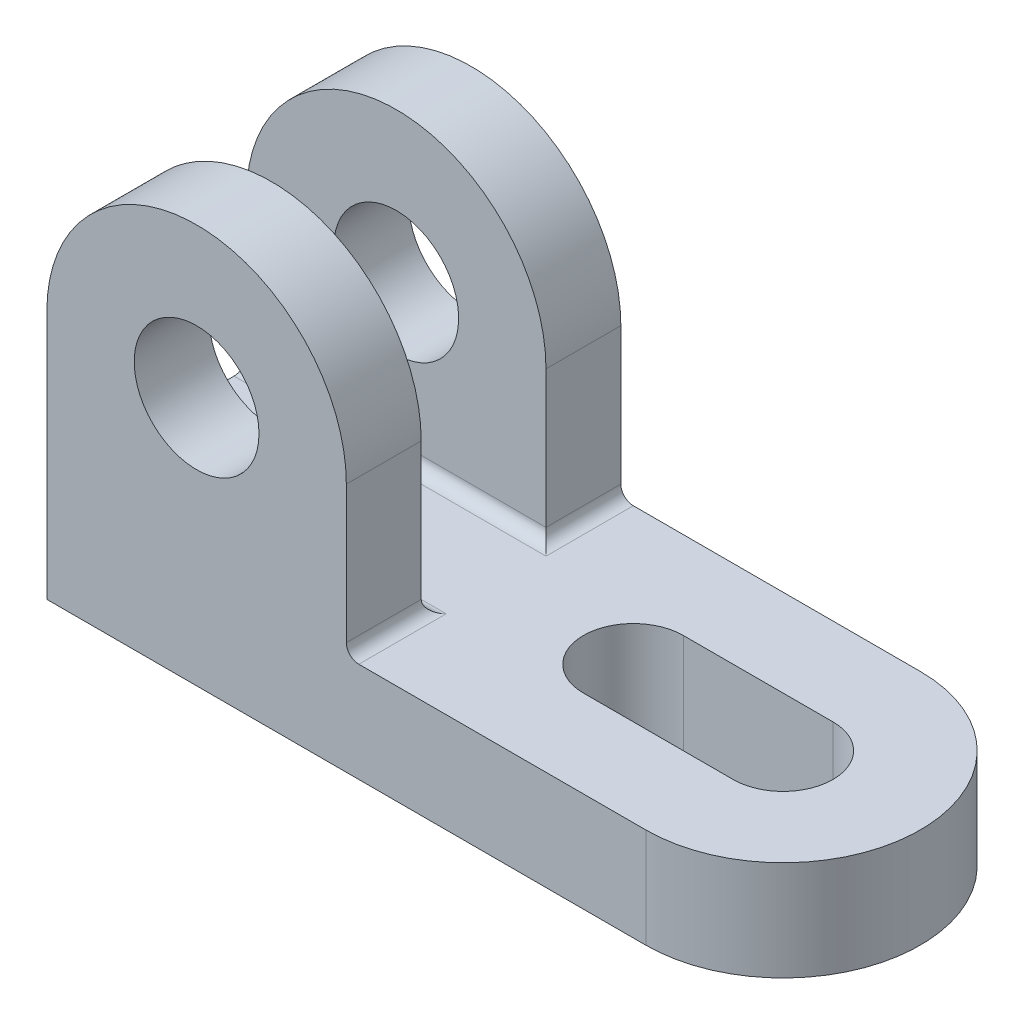
from build123d import *

# Parameters (mm, degrees)
SKETCH1_R           = 22
BOSS_EXTRUDE3_DEPTH = 16
CUT_EXTRUDE1_DEPTH  = 127.94880858
SKETCH3_R           = 24
SKETCH3_W           = 48
SKETCH3_H           = 24
BOSS_EXTRUDE5_DEPTH = 12
SKETCH6_R           = 10
CUT_EXTRUDE3_DEPTH  = 142.265707091
FILLET3_R           = 2


with BuildPart() as part:
    # Sketch1 → Boss-Extrude3 (new body)
    with BuildSketch(Plane(origin=(0, 0, 0), x_dir=(1, 0, 0), z_dir=(0, 1, 0))):
        with BuildLine():
            Line((0, 44), (0, 0))
            Line((0, 0), (96, 0))
            ThreePointArc((96, 0), (74, 22), (96, 44))
            Line((96, 44), (0, 44))
        make_face()
        with Locations((96, 22)):
            Circle(SKETCH1_R)
    extrude(amount=BOSS_EXTRUDE3_DEPTH)

    # Sketch2 → Cut-Extrude1 (cut, through all)
    with BuildSketch(Plane(origin=(0, 16, 0), x_dir=(1, 0, 0), z_dir=(0, 1, 0))):
        with BuildLine():
            Line((72, 30), (96, 30))
            ThreePointArc((96, 30), (104, 22), (96, 14))
            Line((96, 14), (72, 14))
            ThreePointArc((72, 14), (64, 22), (72, 30))
        make_face()
    extrude(amount=-CUT_EXTRUDE1_DEPTH, mode=Mode.SUBTRACT)

    # Sketch3 → Boss-Extrude5 (add)
    with BuildSketch(Plane.XY):
        with Locations((24, 40)):
            Circle(SKETCH3_R)
        with Locations((24, 28)):
            Rectangle(SKETCH3_W, SKETCH3_H)
    boss_extrude5 = extrude(amount=-BOSS_EXTRUDE5_DEPTH)

    # Sketch6 → Cut-Extrude3 (cut, through all)
    with BuildSketch(Plane.XY):
        with Locations((24, 40)):
            Circle(SKETCH6_R)
    cut_extrude3 = extrude(amount=-CUT_EXTRUDE3_DEPTH, mode=Mode.SUBTRACT)

    # Mirror3: Boss-Extrude5, Cut-Extrude3 across plane
    add(boss_extrude5.mirror(Plane.XY.offset(-22)))
    add(cut_extrude3.mirror(Plane.XY.offset(-22)), mode=Mode.SUBTRACT)

    # Fillet3
    fillet3_edges = [part.edges().sort_by_distance(p)[0] for p in [
        (48, 16, -6),
        (24, 16, -12),
        (48, 16, -38),
        (24, 16, -32),
    ]]
    fillet(fillet3_edges, radius=FILLET3_R)


solid = part.part
